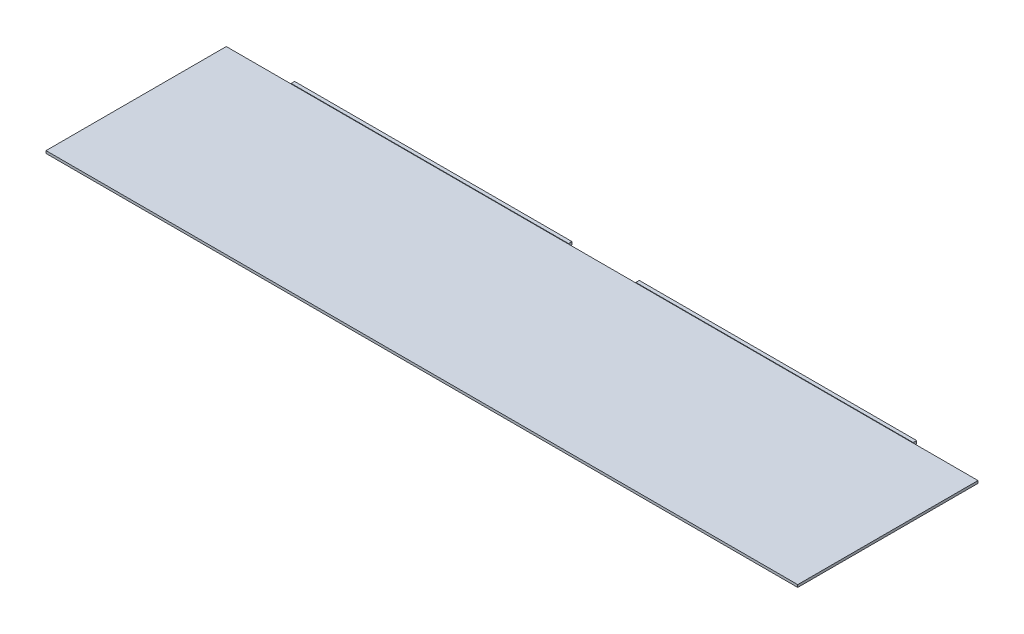
from build123d import *

# Parameters (mm, degrees)
SKETCH1_W           = 688.4416
SKETCH1_H           = 165.1
BOSS_EXTRUDE1_DEPTH = 1.143
SKETCH2_W           = 254
SKETCH2_H           = 2.7305
BOSS_EXTRUDE2_DEPTH = 3.175


with BuildPart() as part:
    # Sketch1 → Boss-Extrude1 (new, symmetric)
    with BuildSketch(Plane(origin=(0, 0, 0), x_dir=(1, 0, 0), z_dir=(0, 1, 0))):
        Rectangle(SKETCH1_W, SKETCH1_H)
    extrude(amount=BOSS_EXTRUDE1_DEPTH, both=True)

    # Sketch2 → Boss-Extrude2 (add)
    with BuildSketch(Plane(origin=(0, 0, -82.55), x_dir=(-1, 0, 0), z_dir=(0, 0, -1))):
        with Locations((-157.8229, 0.22225)):
            Rectangle(SKETCH2_W, SKETCH2_H)
        with Locations((157.8229, 0.22225)):
            Rectangle(SKETCH2_W, SKETCH2_H)
    extrude(amount=BOSS_EXTRUDE2_DEPTH)


solid = part.part
